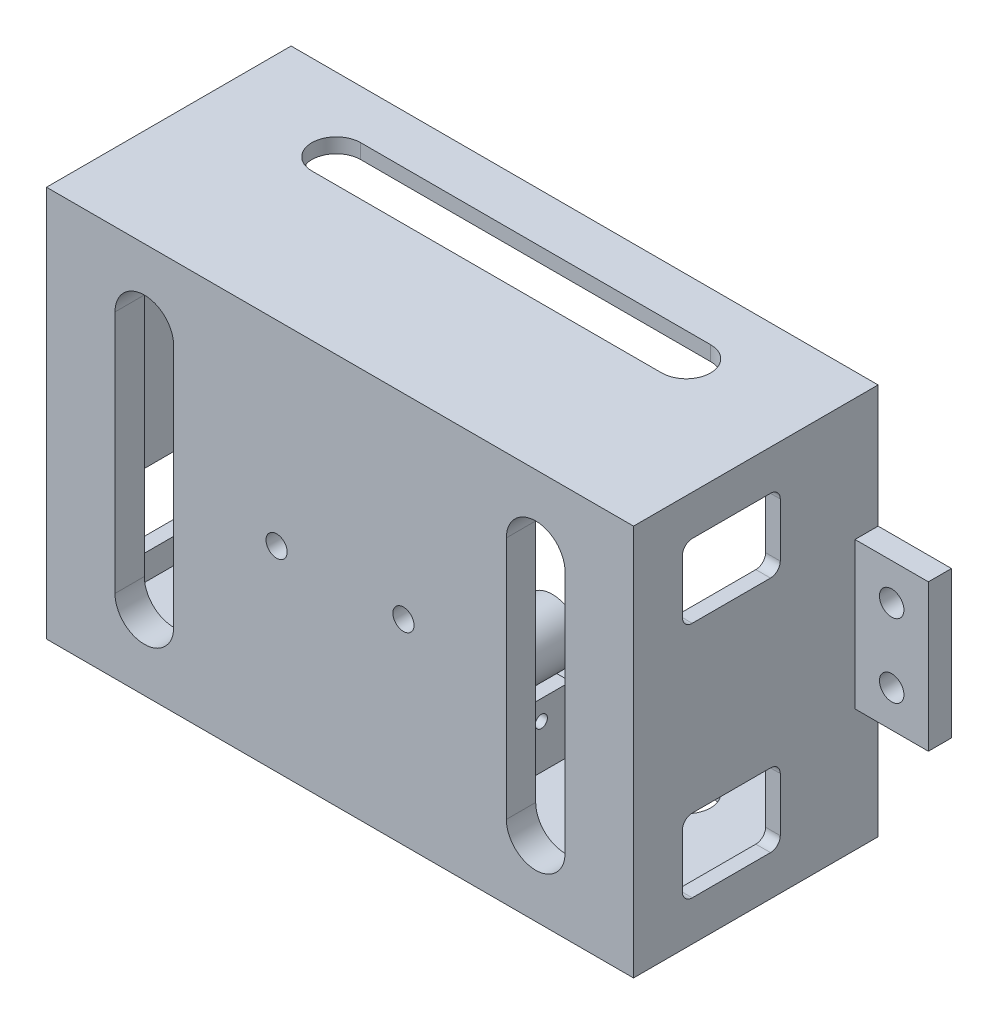
from build123d import *

# Parameters (mm, degrees)
SKETCH1_W            = 120
SKETCH1_H            = 80
BOSS_EXTRUDE1_DEPTH  = 60
SHELL3_T             = -6
SKETCH2_W            = 4.722426826
SKETCH2_H            = 30
BOSS_EXTRUDE2_DEPTH  = 15
SKETCH3_W            = 5
SKETCH3_H            = 30
BOSS_EXTRUDE3_DEPTH  = 15
SKETCH4_R            = 2.5
CUT_EXTRUDE2_DEPTH   = 5
CUT_EXTRUDE3_REACH   = 155.052
CUT_EXTRUDE4_DEPTH   = 6
SKETCH7_R            = 2.16
CUT_EXTRUDE5_DEPTH   = 6
SKETCH9_W            = 108
SKETCH9_H            = 68
BOSS_EXTRUDE4_DEPTH  = 10
SKETCH12_R           = 2.16
CUT_EXTRUDE6_DEPTH   = 10
SKETCH13_W           = 120
SKETCH13_H           = 80
CUT_EXTRUDE7_DEPTH   = 10
CUT_EXTRUDE8_REACH   = 122.52
CUT_EXTRUDE9_START   = -44
SKETCH17_W           = 114
SKETCH17_H           = 74
SKETCH17_W_2         = 108
SKETCH17_H_2         = 68
CUT_EXTRUDE9_DEPTH   = 44
BOSS_EXTRUDE5_DEPTH  = 10
SKETCH24_W           = 8.396994042
SKETCH24_H           = 18.728288782
BOSS_EXTRUDE6_DEPTH  = 5
SKETCH28_W           = 3
SKETCH28_H           = 13.054996367
BOSS_EXTRUDE8_DEPTH  = 24
SKETCH29_R           = 1.25
CUT_EXTRUDE10_DEPTH  = 48
SKETCH30_R           = 6
SKETCH30_R_2         = 3
BOSS_EXTRUDE9_DEPTH  = 10
SKETCH31_R           = 6
SKETCH31_R_2         = 1.5
BOSS_EXTRUDE10_DEPTH = 2


with BuildPart() as part:
    # Sketch1 → Boss-Extrude1 (new body)
    with BuildSketch(Plane.XY):
        Rectangle(SKETCH1_W, SKETCH1_H)
    extrude(amount=BOSS_EXTRUDE1_DEPTH)

    # Shell3
    shell3_openings = [part.faces().sort_by_distance(p)[0] for p in [
        (0, 0, 0),
    ]]
    offset(amount=SHELL3_T, openings=shell3_openings, kind=Kind.INTERSECTION)

    # Sketch2 → Boss-Extrude2 (add)
    with BuildSketch(Plane(origin=(60, 0, 0), x_dir=(0, 0, -1), z_dir=(1, 0, 0))):
        with Locations((-2.361213413, 0)):
            Rectangle(SKETCH2_W, SKETCH2_H)
    extrude(amount=BOSS_EXTRUDE2_DEPTH)

    # Sketch3 → Boss-Extrude3 (add)
    with BuildSketch(Plane.ZY.offset(60)):
        with Locations((2.5, 0)):
            Rectangle(SKETCH3_W, SKETCH3_H)
    extrude(amount=BOSS_EXTRUDE3_DEPTH)

    # Sketch4 → Cut-Extrude2 (cut)
    with BuildSketch(Plane.XY.offset(5)):
        with Locations((-67.5, 7.5)):
            Circle(SKETCH4_R)
        with Locations((-67.5, -7.5)):
            Circle(SKETCH4_R)
        with Locations((67.5, -7.5)):
            Circle(SKETCH4_R)
        with Locations((67.5, 7.5)):
            Circle(SKETCH4_R)
    extrude(amount=-CUT_EXTRUDE2_DEPTH, mode=Mode.SUBTRACT)

    # Cut-Extrude3: up to this face of the body (flat: up to its plane)
    cut_extrude3_end = Plane(part.part.faces().sort_by_distance((-60, 0, 30.887096774))[0])
    # Sketch5 → Cut-Extrude3 (cut, up to the picked face)
    with BuildSketch(Plane(origin=(60, 0, 0), x_dir=(0, 0, -1), z_dir=(1, 0, 0)), mode=Mode.PRIVATE) as cut_extrude3_sk1:
        with BuildLine():
            Line((-38, 31.802865199), (-22, 31.802865199))
            ThreePointArc((-22, 31.802865199), (-20.585786438, 31.217078762), (-20, 29.802865199))
            Line((-20, 29.802865199), (-20, 18.802865199))
            ThreePointArc((-20, 18.802865199), (-20.585786438, 17.388651637), (-22, 16.802865199))
            Line((-22, 16.802865199), (-38, 16.802865199))
            ThreePointArc((-38, 16.802865199), (-39.414213562, 17.388651637), (-40, 18.802865199))
            Line((-40, 18.802865199), (-40, 29.802865199))
            ThreePointArc((-40, 29.802865199), (-39.414213562, 31.217078762), (-38, 31.802865199))
        make_face()
    cut_extrude3_tool1 = split(extrude(cut_extrude3_sk1.sketch, amount=-CUT_EXTRUDE3_REACH, mode=Mode.PRIVATE), bisect_by=cut_extrude3_end, keep=Keep.BOTH, mode=Mode.PRIVATE)
    # Sketch5 → Cut-Extrude3 (cut, up to the picked face)
    with BuildSketch(Plane(origin=(60, 0, 0), x_dir=(0, 0, -1), z_dir=(1, 0, 0)), mode=Mode.PRIVATE) as cut_extrude3_sk2:
        with BuildLine():
            Line((-20, -29.802865199), (-20, -18.802865199))
            ThreePointArc((-20, -18.802865199), (-20.585786438, -17.388651637), (-22, -16.802865199))
            Line((-22, -16.802865199), (-38, -16.802865199))
            ThreePointArc((-38, -16.802865199), (-39.414213562, -17.388651637), (-40, -18.802865199))
            Line((-40, -18.802865199), (-40, -29.802865199))
            ThreePointArc((-40, -29.802865199), (-39.414213562, -31.217078762), (-38, -31.802865199))
            Line((-38, -31.802865199), (-22, -31.802865199))
            ThreePointArc((-22, -31.802865199), (-20.585786438, -31.217078762), (-20, -29.802865199))
        make_face()
    cut_extrude3_tool2 = split(extrude(cut_extrude3_sk2.sketch, amount=-CUT_EXTRUDE3_REACH, mode=Mode.PRIVATE), bisect_by=cut_extrude3_end, keep=Keep.BOTH, mode=Mode.PRIVATE)
    add(cut_extrude3_tool1.solids().sort_by(Axis((60, 24.302865, 30), (-1, 0, 0)))[0], mode=Mode.SUBTRACT)
    add(cut_extrude3_tool2.solids().sort_by(Axis((60, -24.302865, 30), (-1, 0, 0)))[0], mode=Mode.SUBTRACT)

    # Sketch6 → Cut-Extrude4 (cut)
    with BuildSketch(Plane.XY.offset(60)):
        with BuildLine():
            Line((-34, 24.918850814), (-34, -24.918850814))
            ThreePointArc((-34, -24.918850814), (-40, -30.918850814), (-46, -24.918850814))
            Line((-46, -24.918850814), (-46, 24.918850814))
            ThreePointArc((-46, 24.918850814), (-40, 30.918850814), (-34, 24.918850814))
        make_face()
        with BuildLine():
            Line((34, 24.918850814), (34, -24.918850814))
            ThreePointArc((34, -24.918850814), (40, -30.918850814), (46, -24.918850814))
            Line((46, -24.918850814), (46, 24.918850814))
            ThreePointArc((46, 24.918850814), (40, 30.918850814), (34, 24.918850814))
        make_face()
    extrude(amount=-CUT_EXTRUDE4_DEPTH, mode=Mode.SUBTRACT)

    # Sketch7 → Cut-Extrude5 (cut)
    with BuildSketch(Plane(origin=(0, 0, 54), x_dir=(-1, 0, 0), z_dir=(0, 0, -1))):
        with Locations((-12.965, 0)):
            Circle(SKETCH7_R)
        with Locations((12.965, 0)):
            Circle(SKETCH7_R)
    extrude(amount=-CUT_EXTRUDE5_DEPTH, mode=Mode.SUBTRACT)

    # Sketch9 → Boss-Extrude4 (add)
    with BuildSketch(Plane(origin=(0, 0, 54), x_dir=(-1, 0, 0), z_dir=(0, 0, -1))):
        Rectangle(SKETCH9_W, SKETCH9_H)
    extrude(amount=BOSS_EXTRUDE4_DEPTH)

    # Sketch12 → Cut-Extrude6 (cut)
    with BuildSketch(Plane.XY.offset(54)):
        with Locations(Location((12.965, 0, 0), (0, 0, 180))):
            Circle(SKETCH12_R)
        with Locations(Location((-12.965, 0, 0), (0, 0, 180))):
            Circle(SKETCH12_R)
        with BuildLine():
            Line((46, -24.918850814), (46, 24.918850814))
            ThreePointArc((46, 24.918850814), (40, 30.918850814), (34, 24.918850814))
            Line((34, 24.918850814), (34, -24.918850814))
            ThreePointArc((34, -24.918850814), (40, -30.918850814), (46, -24.918850814))
        make_face()
        with BuildLine():
            Line((-34, -24.918850814), (-34, 24.918850814))
            ThreePointArc((-34, 24.918850814), (-40, 30.918850814), (-46, 24.918850814))
            Line((-46, 24.918850814), (-46, -24.918850814))
            ThreePointArc((-46, -24.918850814), (-40, -30.918850814), (-34, -24.918850814))
        make_face()
    extrude(amount=-CUT_EXTRUDE6_DEPTH, mode=Mode.SUBTRACT)

    # Sketch13 → Cut-Extrude7 (cut)
    with BuildSketch(Plane.XY.offset(60)):
        Rectangle(SKETCH13_W, SKETCH13_H)
    extrude(amount=-CUT_EXTRUDE7_DEPTH, mode=Mode.SUBTRACT)

    # Cut-Extrude8: up to this face of the body (flat: up to its plane)
    cut_extrude8_end = Plane(part.part.faces().sort_by_distance((0, -40, 25))[0])
    # Sketch14 → Cut-Extrude8 (cut, up to the picked face)
    with BuildSketch(Plane(origin=(0, 40, 0), x_dir=(1, 0, 0), z_dir=(0, 1, 0)), mode=Mode.PRIVATE) as cut_extrude8_sk1:
        with BuildLine():
            Line((-35.763165519, -10), (35.763165519, -10))
            ThreePointArc((35.763165519, -10), (40.763165519, -15), (35.763165519, -20))
            Line((35.763165519, -20), (-35.763165519, -20))
            ThreePointArc((-35.763165519, -20), (-40.763165519, -15), (-35.763165519, -10))
        make_face()
    cut_extrude8_tool1 = split(extrude(cut_extrude8_sk1.sketch, amount=-CUT_EXTRUDE8_REACH, mode=Mode.PRIVATE), bisect_by=cut_extrude8_end, keep=Keep.BOTH, mode=Mode.PRIVATE)
    add(cut_extrude8_tool1.solids().sort_by(Axis((0, 40, 15), (0, -1, 0)))[0], mode=Mode.SUBTRACT)

    # Sketch17 → Cut-Extrude9 (cut)
    with BuildSketch(Plane(origin=(0, 0, 0), x_dir=(-1, 0, 0), z_dir=(0, 0, -1)).offset(CUT_EXTRUDE9_START)):
        Rectangle(SKETCH17_W, SKETCH17_H)
        Rectangle(SKETCH17_W_2, SKETCH17_H_2, mode=Mode.SUBTRACT)
    extrude(amount=CUT_EXTRUDE9_DEPTH, mode=Mode.SUBTRACT)

    # Sketch23 → Boss-Extrude5 (add)
    with BuildSketch(Plane(origin=(0, 0, 44), x_dir=(-1, 0, 0), z_dir=(0, 0, -1))):
        Polygon((-17.15, 14.35), (-17.15, 5), (-14.15, 5), (-14.15, 11.35), (14.15, 11.35), (14.15, 5), (17.15, 5), (17.15, 14.35), align=None)
    extrude(amount=BOSS_EXTRUDE5_DEPTH)

    # Sketch24 → Boss-Extrude6 (add)
    with BuildSketch(Plane(origin=(0, 0, 44), x_dir=(-1, 0, 0), z_dir=(0, 0, -1))):
        Rectangle(SKETCH24_W, SKETCH24_H)
    extrude(amount=BOSS_EXTRUDE6_DEPTH)

    # Sketch28 → Boss-Extrude8 (add)
    with BuildSketch(Plane(origin=(0, 0, 44), x_dir=(-1, 0, 0), z_dir=(0, 0, -1))):
        with Locations((-15.65, -30.472501816)):
            Rectangle(SKETCH28_W, SKETCH28_H)
        with Locations((15.65, -30.472501816)):
            Rectangle(SKETCH28_W, SKETCH28_H)
    extrude(amount=BOSS_EXTRUDE8_DEPTH)

    # Sketch29 → Cut-Extrude10 (cut)
    with BuildSketch(Plane.ZY.offset(17.15)):
        with Locations((26, -28)):
            Circle(SKETCH29_R)
    extrude(amount=-CUT_EXTRUDE10_DEPTH, mode=Mode.SUBTRACT)

    # Sketch30 → Boss-Extrude9 (add)
    # profile 1 of 2: a face of its own
    with BuildSketch(Plane(origin=(0, 0, 44), x_dir=(-1, 0, 0), z_dir=(0, 0, -1))):
        with Locations((-25.4, -4.36)):
            Circle(SKETCH30_R)
        with Locations((-25.4, -4.36)):
            Circle(SKETCH30_R_2, mode=Mode.SUBTRACT)
    # profile 2 of 2: a face of its own
    with BuildSketch(Plane(origin=(0, 0, 44), x_dir=(-1, 0, 0), z_dir=(0, 0, -1))):
        with Locations((25.4, 4.36)):
            Circle(SKETCH30_R)
        with Locations((25.4, 4.36)):
            Circle(SKETCH30_R_2, mode=Mode.SUBTRACT)
    extrude(amount=BOSS_EXTRUDE9_DEPTH)

    # Sketch31 → Boss-Extrude10 (add)
    # profile 1 of 2: a face of its own
    with BuildSketch(Plane(origin=(0, 0, 34), x_dir=(-1, 0, 0), z_dir=(0, 0, -1))):
        with Locations((-25.4, -4.36)):
            Circle(SKETCH31_R)
        with Locations((-25.4, -4.36)):
            Circle(SKETCH31_R_2, mode=Mode.SUBTRACT)
    # profile 2 of 2: a face of its own
    with BuildSketch(Plane(origin=(0, 0, 34), x_dir=(-1, 0, 0), z_dir=(0, 0, -1))):
        with Locations((25.4, 4.36)):
            Circle(SKETCH31_R)
        with Locations((25.4, 4.36)):
            Circle(SKETCH31_R_2, mode=Mode.SUBTRACT)
    extrude(amount=BOSS_EXTRUDE10_DEPTH)


solid = part.part
